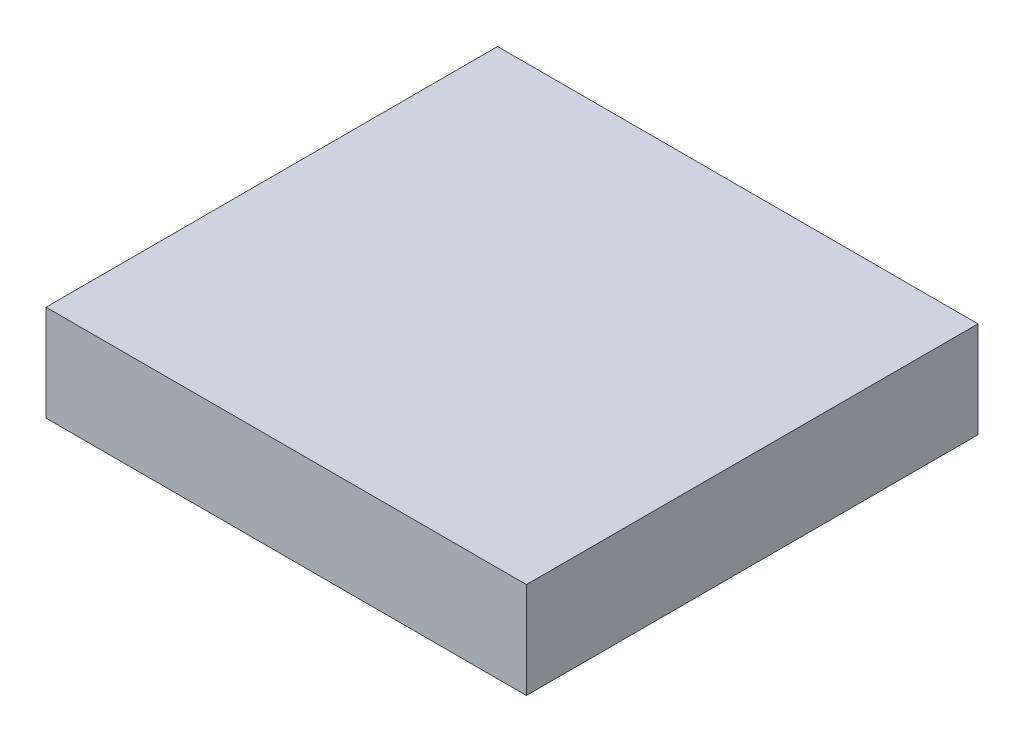
from build123d import *

# Parameters (mm, degrees)
SKETCH1_W           = 100
SKETCH1_H           = 94
BOSS_EXTRUDE1_DEPTH = 20


with BuildPart() as part:
    # Sketch1 → Boss-Extrude1 (new body)
    with BuildSketch(Plane(origin=(0, 0, 0), x_dir=(1, 0, 0), z_dir=(0, 1, 0))):
        Rectangle(SKETCH1_W, SKETCH1_H)
    extrude(amount=BOSS_EXTRUDE1_DEPTH)


solid = part.part
